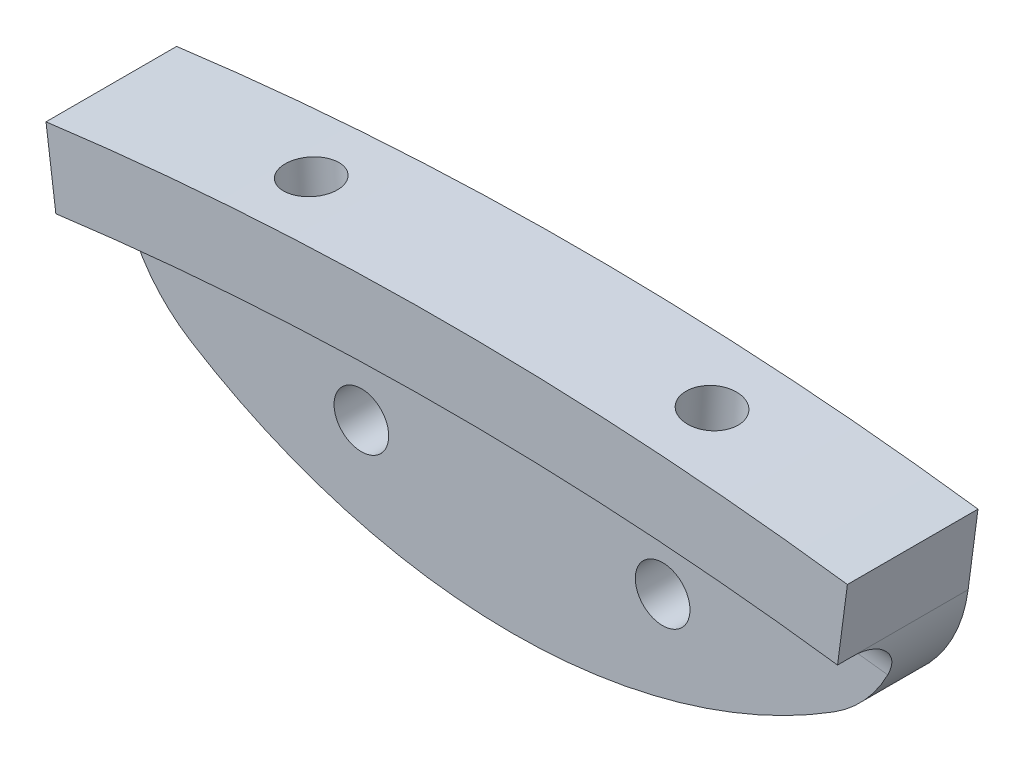
from build123d import *

# Parameters (mm, degrees)
SKETCH1_R               = 1.7272
BOSS_EXTRUDE1_DEPTH     = 4.1275
BOSS_EXTRUDE2_DEPTH     = 4.1275
CUT_EXTRUDE1_REACH      = 44.54
CUT_EXTRUDE1_END_RADIUS = 189.0395
SKETCH4_R               = 1.651
CIRPATTERN1_COUNT       = 2
CIRPATTERN1_ANGLE       = 7.5
FILLET1_R               = 3.175


with BuildPart() as part:
    # Sketch1 → Boss-Extrude1 (new body)
    with BuildSketch(Plane.XY):
        with BuildLine():
            Line((-25.327250623, 192.011812139), (-24.704449379, 187.290210201))
            ThreePointArc((-24.704449379, 187.290210201), (-23.274534977, 183.386752893), (-20.318230022, 180.464100817))
            ThreePointArc((-20.318230022, 180.464100817), (0, 174.625), (20.318230022, 180.464100817))
            ThreePointArc((20.318230022, 180.464100817), (23.274534977, 183.386752893), (24.704449379, 187.290210201))
            Line((24.704449379, 187.290210201), (25.327250623, 192.011812139))
            ThreePointArc((25.327250623, 192.011812139), (0, 193.675), (-25.327250623, 192.011812139))
        make_face()
        with Locations((-9.520641414, 181.519243783)):
            Circle(SKETCH1_R, mode=Mode.SUBTRACT)
        with Locations((9.520641414, 181.519243783)):
            Circle(SKETCH1_R, mode=Mode.SUBTRACT)
    extrude(amount=BOSS_EXTRUDE1_DEPTH)

    # Sketch2 → Boss-Extrude2 (add)
    with BuildSketch(Plane.XY.offset(4.1275)):
        with BuildLine():
            Line((24.704449379, 187.290210201), (25.327250623, 192.011812139))
            ThreePointArc((25.327250623, 192.011812139), (0, 193.675), (-25.327250623, 192.011812139))
            Line((-25.327250623, 192.011812139), (-24.704449379, 187.290210201))
            ThreePointArc((-24.704449379, 187.290210201), (0, 188.9125), (24.704449379, 187.290210201))
        make_face()
    extrude(amount=BOSS_EXTRUDE2_DEPTH)

    # Cut-Extrude1: up to this cylinder (the profile starts outside it)
    cut_extrude1_end = Plane(origin=(0, 0, 4.1275), z_dir=(0, 0, -1)) * Cylinder(CUT_EXTRUDE1_END_RADIUS, 468.159, mode=Mode.PRIVATE)
    # Sketch4 → Cut-Extrude1 (cut, up to the surface)
    with BuildSketch(Plane(origin=(-12.690900461, 193.258755741, 4.1275), x_dir=(-0.9978508105891094, -0.06552678693982746, 0), z_dir=(0.06552678693982746, -0.9978508105891094, 0)), mode=Mode.PRIVATE) as cut_extrude1_sk1:
        Circle(SKETCH4_R)
    cut_extrude1_tool1 = extrude(cut_extrude1_sk1.sketch, amount=CUT_EXTRUDE1_REACH, mode=Mode.PRIVATE) - cut_extrude1_end
    cut_extrude1 = cut_extrude1_tool1.solids().sort_by_distance((-12.6909, 193.258756, 4.1275))[0]
    add(cut_extrude1, mode=Mode.SUBTRACT)

    # CirPattern1: Cut-Extrude1 ×2 about axis
    cirpattern1_axis = Axis((0, 0, 0), (0, 0, -1))
    for i in range(1, CIRPATTERN1_COUNT):
        add(cut_extrude1.rotate(cirpattern1_axis, i * CIRPATTERN1_ANGLE / (CIRPATTERN1_COUNT - 1)), mode=Mode.SUBTRACT)

    # Fillet1
    fillet1_edges = [part.edges().sort_by_distance(p)[0] for p in [
        (0, 188.9125, 4.1275),
    ]]
    fillet(fillet1_edges, radius=FILLET1_R)


solid = part.part
